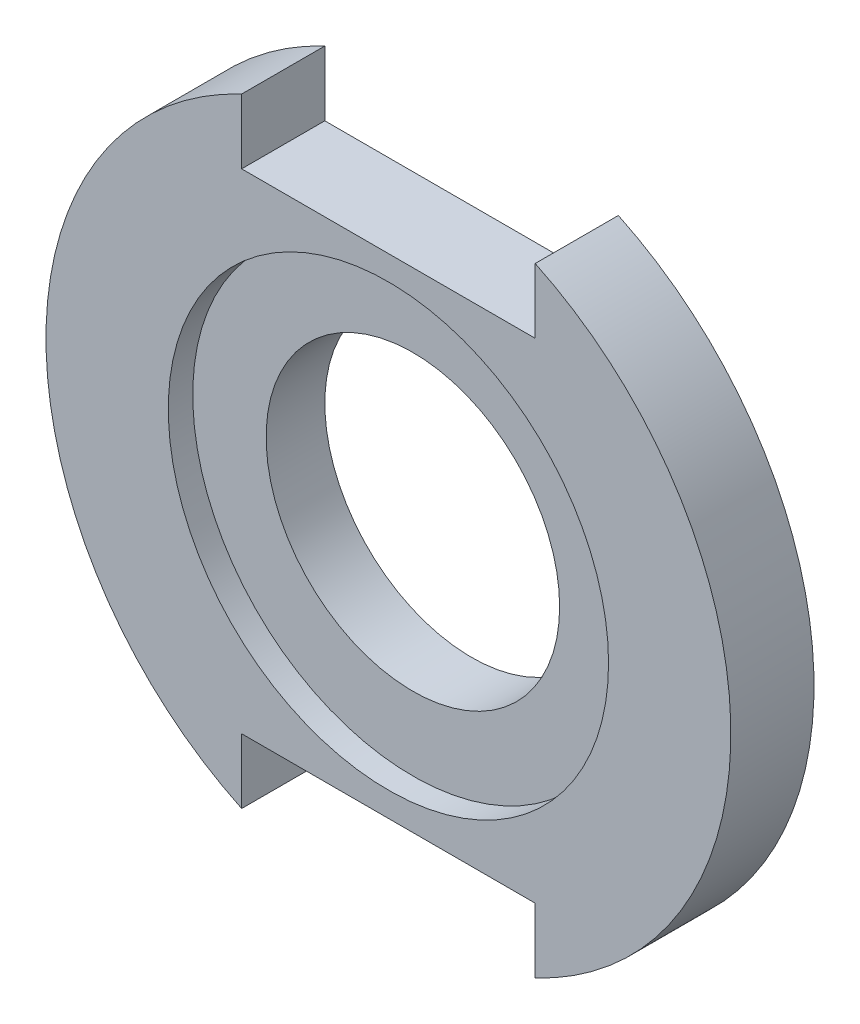
from build123d import *

# Parameters (mm, degrees)
SKETCH_1_R          = 14
EXTRUDE_1_DEPTH     = 3.4
SKETCH_2_R          = 6
CUT_EXTRUDE_1_DEPTH = 3.4
SKETCH_3_W          = 12
SKETCH_3_H          = 8
CUT_EXTRUDE_2_DEPTH = 3.4
SKETCH_4_R          = 9
CUT_EXTRUDE_3_DEPTH = 1


with BuildPart() as part:
    # 스케치1 → 보스-돌출1 (new body)
    with BuildSketch(Plane.XY):
        Circle(SKETCH_1_R)
    extrude(amount=EXTRUDE_1_DEPTH)

    # 스케치2 → 컷-돌출1 (cut)
    with BuildSketch(Plane.XY.offset(3.4)):
        Circle(SKETCH_2_R)
    extrude(amount=-CUT_EXTRUDE_1_DEPTH, mode=Mode.SUBTRACT)

    # 스케치3 → 컷-돌출2 (cut)
    with BuildSketch(Plane.XY.offset(3.4)):
        with Locations((0, 14)):
            Rectangle(SKETCH_3_W, SKETCH_3_H)
        with Locations((0, -14)):
            Rectangle(SKETCH_3_W, SKETCH_3_H)
    extrude(amount=-CUT_EXTRUDE_2_DEPTH, mode=Mode.SUBTRACT)

    # 스케치4 → 컷-돌출3 (cut)
    with BuildSketch(Plane.XY.offset(3.4)):
        Circle(SKETCH_4_R)
    extrude(amount=-CUT_EXTRUDE_3_DEPTH, mode=Mode.SUBTRACT)


solid = part.part
